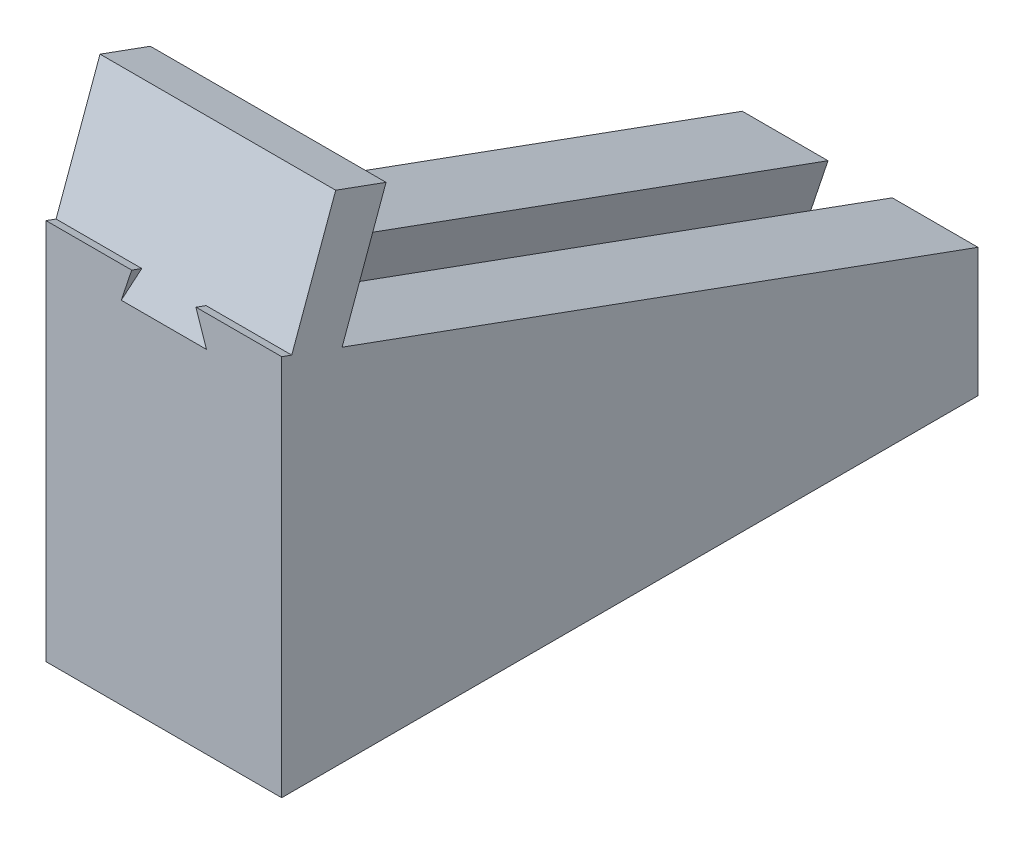
from build123d import *

# Parameters (mm, degrees)
BOSS_EXTRUDE1_DEPTH = 11
BOSS_EXTRUDE2_REACH = 31.074


with BuildPart() as part:
    # Sketch2 → Boss-Extrude1 (new body)
    with BuildSketch(Plane(origin=(0, 0, 0), x_dir=(0, 0, -1), z_dir=(1, 0, 0))):
        Polygon((-7.428495294, -9.782945939), (25.071504706, -9.782945939), (25.071504706, -3.782945939), (-7.428495294, 8.046086675), align=None)
    extrude(amount=-BOSS_EXTRUDE1_DEPTH)

    # Cut-Sweep3: sweep along a path in Sketch5
    with BuildLine(Plane.ZY.offset(11)) as cut_sweep3_path:
        Line((-25.071504706, -6.975479256), (8.757429642, 5.337245904))
    # Sketch3 → Cut-Sweep3 (sweep, cut)
    with BuildSketch(Plane(origin=(0, 0, -25.071504706), x_dir=(-1, 0, 0), z_dir=(0, 0, -1))):
        Polygon((3, -6.782945939), (8, -6.782945939), (7, -3.782945939), (4, -3.782945939), align=None)
    sweep(path=cut_sweep3_path.line, mode=Mode.SUBTRACT)

    # Boss-Extrude2: up to this face of the body (flat: up to its plane)
    boss_extrude2_end = Plane(part.part.faces().sort_by_distance((0, -3.336347692, -6.132602991))[0])
    # Sketch6 → Boss-Extrude2 (add, up to the picked face)
    with BuildSketch(Plane.ZY.offset(11), mode=Mode.PRIVATE) as boss_extrude2_sk1:
        Polygon((5.635477862, 4.200948383), (7.428495294, 4.853553358), (7.428495294, 6.584184475), (4.906528124, 13.513232328), (2.557296572, 12.65818197), align=None)
    boss_extrude2_tool1 = split(extrude(boss_extrude2_sk1.sketch, amount=-BOSS_EXTRUDE2_REACH, mode=Mode.PRIVATE), bisect_by=boss_extrude2_end, keep=Keep.BOTH, mode=Mode.PRIVATE)
    add(boss_extrude2_tool1.solids().sort_by(Axis((-11, 8.930518, 5.21979), (1, 0, 0)))[0])


solid = part.part
